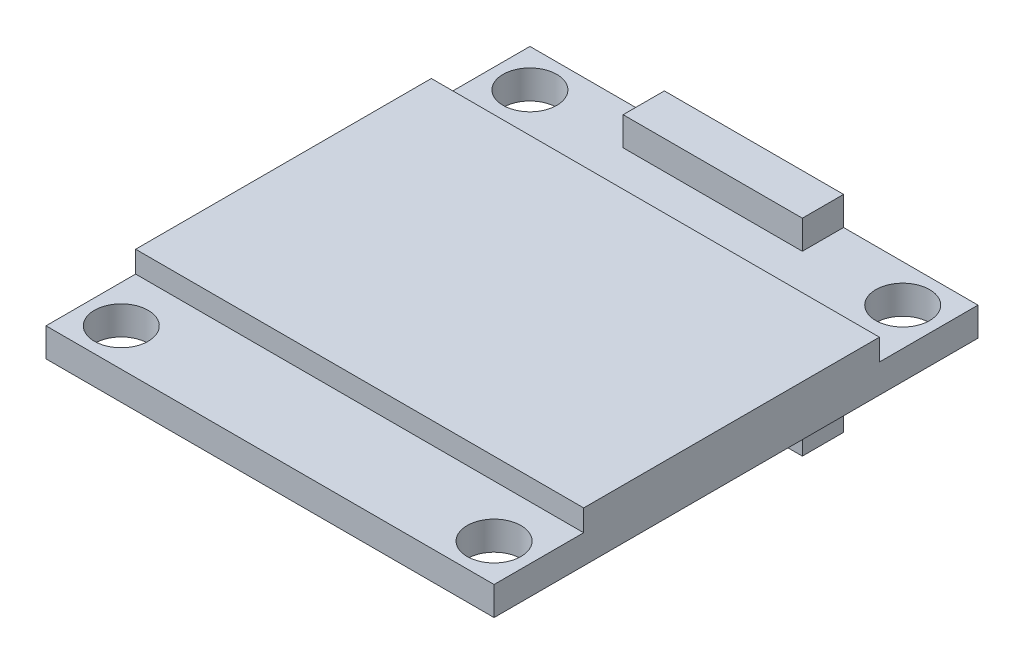
from build123d import *

# Parameters (mm, degrees)
SKETCH_1_W           = 25
SKETCH_1_H           = 27
EXTRUDE_1_DEPTH      = 1.6
SKETCH_2_W           = 25
SKETCH_2_H           = 16.5
EXTRUDE_2_DEPTH      = 1.2
SKETCH_3_R           = 1.5
CUT_EXTRUDE_1_DEPTH  = 37.83150825
EXTRUDE_4_DEPTH      = 1.6
EXTRUDE_4_DEPTH_BACK = 9.9
SKETCH_5_W           = 10
SKETCH_5_H           = 2.3


with BuildPart() as part:
    # 草图1 → 凸台-拉伸1 (new body)
    with BuildSketch(Plane(origin=(0, 0, 0), x_dir=(1, 0, 0), z_dir=(0, 1, 0))):
        with Locations((12.5, 13.5)):
            Rectangle(SKETCH_1_W, SKETCH_1_H)
    extrude(amount=EXTRUDE_1_DEPTH)

    # 草图2 → 凸台-拉伸2 (add)
    with BuildSketch(Plane(origin=(0, 1.6, 0), x_dir=(1, 0, 0), z_dir=(0, 1, 0))):
        with Locations((12.5, 13.25)):
            Rectangle(SKETCH_2_W, SKETCH_2_H)
    extrude(amount=EXTRUDE_2_DEPTH)

    # 草图3 → 切除-拉伸1 (cut, through all)
    with BuildSketch(Plane(origin=(0, 1.6, 0), x_dir=(1, 0, 0), z_dir=(0, 1, 0))):
        with Locations(Location((2.1, 24.9, 0), (0, 0, 270))):
            Circle(SKETCH_3_R)
        with Locations(Location((22.9, 24.9, 0), (0, 0, 90))):
            Circle(SKETCH_3_R)
        with Locations(Location((22.9, 2.1, 0), (0, 0, 270))):
            Circle(SKETCH_3_R)
        with Locations(Location((2.1, 2.1, 0), (0, 0, 90))):
            Circle(SKETCH_3_R)
    extrude(amount=-CUT_EXTRUDE_1_DEPTH, mode=Mode.SUBTRACT)

    # 草图5 → 凸台-拉伸4 (add, two sides: drawn at the far end of the back side and taken through both)
    with BuildSketch(Plane(origin=(0, 1.6, 0), x_dir=(1, 0, 0), z_dir=(0, 1, 0)).offset(-EXTRUDE_4_DEPTH_BACK)):
        with Locations((12.5, 25.85)):
            Rectangle(SKETCH_5_W, SKETCH_5_H)
    extrude(amount=EXTRUDE_4_DEPTH + EXTRUDE_4_DEPTH_BACK)


solid = part.part
